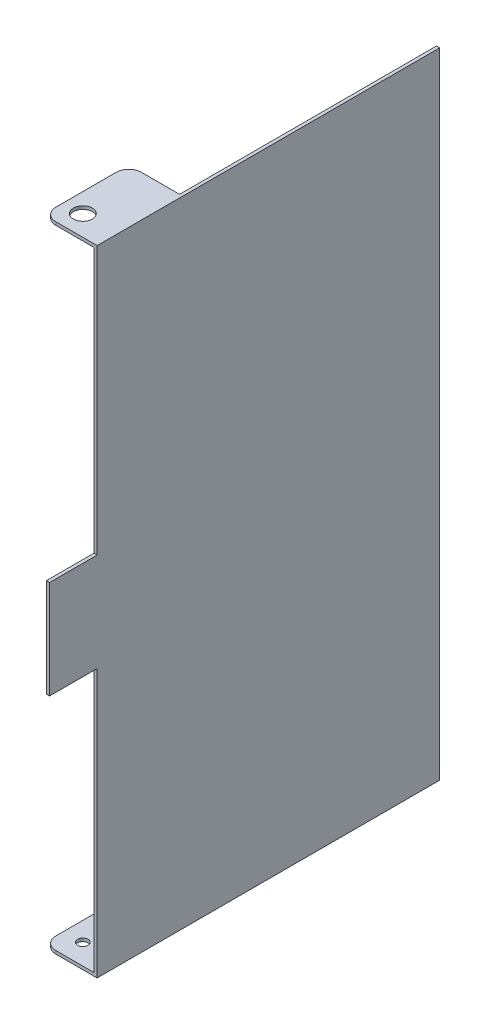
from build123d import *

# Parameters (mm, degrees)
SKETCH1_W           = 200
SKETCH1_H           = 108
BOSS_EXTRUDE1_DEPTH = 1
SKETCH3_W           = 16
SKETCH3_H           = 27
BOSS_EXTRUDE2_DEPTH = 1
CUT_EXTRUDE1_REACH  = 209.858
SKETCH4_R           = 3
FILLET2_R           = 4
CUT_EXTRUDE2_REACH  = 209.858
SKETCH6_R           = 1.65
FILLET3_R           = 4
SKETCH7_W           = 1
SKETCH7_H           = 31
BOSS_EXTRUDE3_DEPTH = 15


with BuildPart() as part:
    # Sketch1 → Boss-Extrude1 (new body)
    with BuildSketch(Plane.YZ):
        Rectangle(SKETCH1_W, SKETCH1_H)
    extrude(amount=-BOSS_EXTRUDE1_DEPTH)

    # Sketch3 → Boss-Extrude2 (add)
    with BuildSketch(Plane(origin=(0, 100, 0), x_dir=(-1, 0, 0), z_dir=(0, 1, 0))):
        with Locations((9, 40.5)):
            Rectangle(SKETCH3_W, SKETCH3_H)
    boss_extrude2 = extrude(amount=-BOSS_EXTRUDE2_DEPTH)

    # Sketch4 → Cut-Extrude1 (cut, up to next)
    with BuildSketch(Plane(origin=(0, 100, 0), x_dir=(-1, 0, 0), z_dir=(0, 1, 0)), mode=Mode.PRIVATE) as cut_extrude1_sk1:
        with Locations(Location((11, 47.5, 0), (0, 0, 90))):
            Circle(SKETCH4_R)
    cut_extrude1_tool1 = extrude(cut_extrude1_sk1.sketch, amount=-CUT_EXTRUDE1_REACH, mode=Mode.PRIVATE) & part.part
    add(cut_extrude1_tool1.solids().sort_by_distance((-11, 100, 47.5))[0], mode=Mode.SUBTRACT)

    # Fillet2
    fillet2_edges = [part.edges().sort_by_distance(p)[0] for p in [
        (-17, 99.5, 54),
        (-17, 99.5, 27),
    ]]
    fillet(fillet2_edges, radius=FILLET2_R)

    # Mirror1: Boss-Extrude2 across plane
    add(boss_extrude2.mirror(Plane.ZX))

    # Sketch6 → Cut-Extrude2 (cut, up to next)
    with BuildSketch(Plane.XZ.offset(100), mode=Mode.PRIVATE) as cut_extrude2_sk1:
        with Locations(Location((-11, 47.5, 0), (0, 0, 270))):
            Circle(SKETCH6_R)
    cut_extrude2_tool1 = extrude(cut_extrude2_sk1.sketch, amount=-CUT_EXTRUDE2_REACH, mode=Mode.PRIVATE) & part.part
    add(cut_extrude2_tool1.solids().sort_by_distance((-11, -100, 47.5))[0], mode=Mode.SUBTRACT)

    # Fillet3
    fillet3_edges = [part.edges().sort_by_distance(p)[0] for p in [
        (-17, -99.5, 27),
        (-17, -99.5, 54),
    ]]
    fillet(fillet3_edges, radius=FILLET3_R)

    # Sketch7 → Boss-Extrude3 (add, symmetric)
    with BuildSketch(Plane.XY.offset(54)):
        with Locations((-0.5, 0)):
            Rectangle(SKETCH7_W, SKETCH7_H)
    extrude(amount=BOSS_EXTRUDE3_DEPTH, both=True)


solid = part.part
